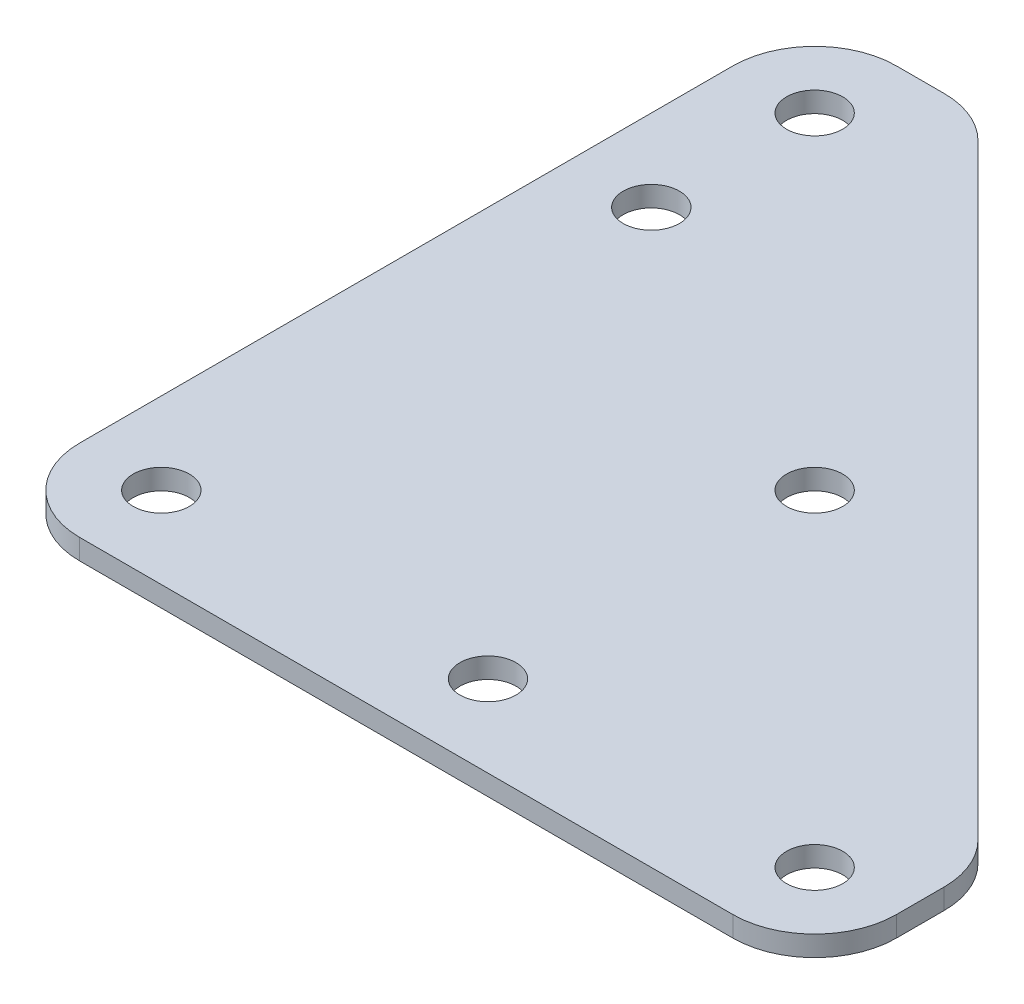
from build123d import *

# Parameters (mm, degrees)
SKETCH1_R           = 2.1828125
BOSS_EXTRUDE1_DEPTH = 0.79375


with BuildPart() as part:
    # Sketch1 → Boss-Extrude1 (new, symmetric)
    with BuildSketch(Plane(origin=(0, 0, 0), x_dir=(1, 0, 0), z_dir=(0, 1, 0))):
        with BuildLine():
            Line((-6.35, 0), (-6.35, 50.8))
            ThreePointArc((-6.35, 50.8), (-4.490128061, 55.290128061), (0, 57.15))
            Line((0, 57.15), (3.719743879, 57.15))
            ThreePointArc((3.719743879, 57.15), (6.149783674, 56.666635031), (8.209871939, 55.290128061))
            Line((8.209871939, 55.290128061), (55.290128061, 8.209871939))
            ThreePointArc((55.290128061, 8.209871939), (56.666635031, 6.149783674), (57.15, 3.719743879))
            Line((57.15, 3.719743879), (57.15, 0))
            ThreePointArc((57.15, 0), (55.290128061, -4.490128061), (50.8, -6.35))
            Line((50.8, -6.35), (0, -6.35))
            ThreePointArc((0, -6.35), (-4.490128061, -4.490128061), (-6.35, 0))
        make_face()
        with Locations(Location((0, 0, 0), (0, 0, 270))):
            Circle(SKETCH1_R, mode=Mode.SUBTRACT)
        with Locations(Location((0, 50.8, 0), (0, 0, 270))):
            Circle(SKETCH1_R, mode=Mode.SUBTRACT)
        with Locations(Location((50.8, 0, 0), (0, 0, 270))):
            Circle(SKETCH1_R, mode=Mode.SUBTRACT)
        with Locations(Location((25.4, 0, 0), (0, 0, 270))):
            Circle(SKETCH1_R, mode=Mode.SUBTRACT)
        with Locations(Location((0, 38.1, 0), (0, 0, 270))):
            Circle(SKETCH1_R, mode=Mode.SUBTRACT)
        with Locations(Location((25.4, 25.4, 0), (0, 0, 270))):
            Circle(SKETCH1_R, mode=Mode.SUBTRACT)
    extrude(amount=BOSS_EXTRUDE1_DEPTH, both=True)


solid = part.part
